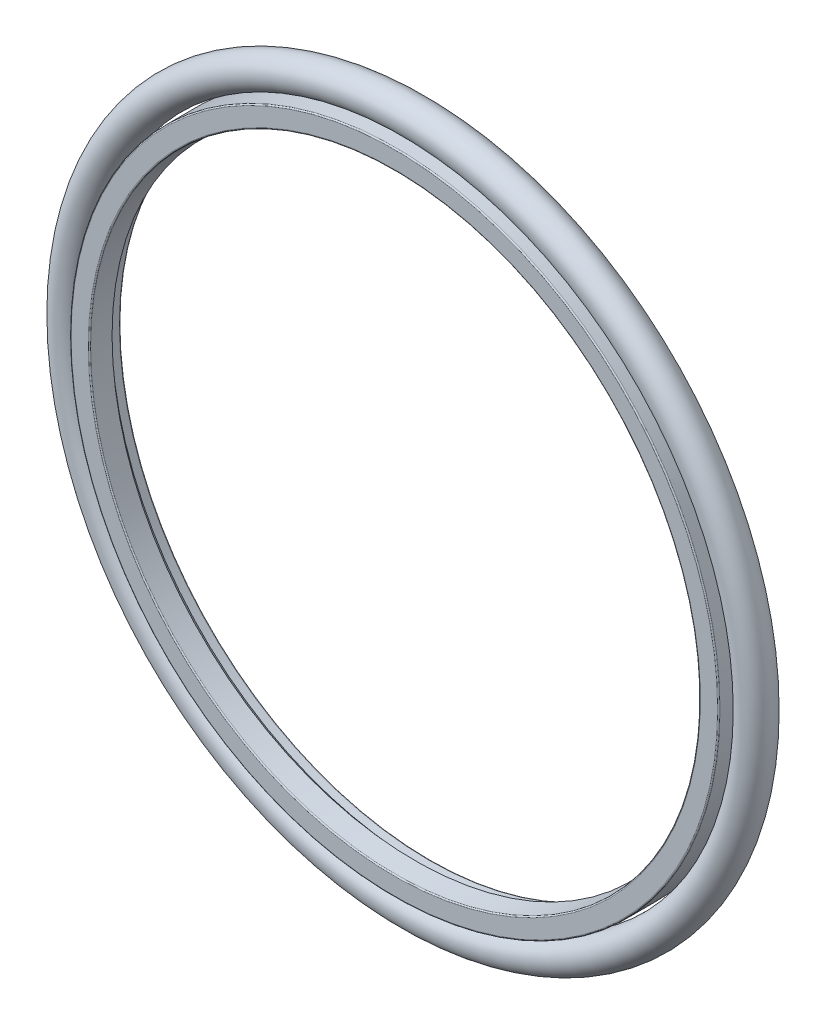
from build123d import *

# Parameters (mm, degrees)
SKETCH4_R = 2.665


with BuildPart() as part:
    # Sketch1 → Revolve1 (revolve)
    with BuildSketch(Plane(origin=(0, 0, 0), x_dir=(0, 0, -1), z_dir=(1, 0, 0)), mode=Mode.PRIVATE) as revolve1_sk:
        with BuildLine():
            Line((0, 51.05), (0, 53.05))
            ThreePointArc((0, 53.05), (-0.058578644, 53.191421356), (-0.2, 53.25))
            Line((-0.2, 53.25), (-5.72, 53.25))
            ThreePointArc((-5.72, 53.25), (-5.861421356, 53.191421356), (-5.92, 53.05))
            Line((-5.92, 53.05), (-5.92, 50.233224133))
            ThreePointArc((-5.92, 50.233224133), (-5.867470929, 50.098122967), (-5.73747675, 50.033989189))
            Line((-5.73747675, 50.033989189), (-2.5, 49.75))
            Line((-2.5, 49.75), (-1.5, 50.85))
            Line((-1.5, 50.85), (-0.2, 50.85))
            ThreePointArc((-0.2, 50.85), (-0.058578644, 50.908578644), (0, 51.05))
        make_face()
    revolve(revolve1_sk.sketch.rotate(Axis((0, 0, 0), (0, 0, 1)), 90), axis=Axis((0, 0, 0), (0, 0, 1)))


with BuildPart() as body_2:
    # Sketch4 → Revolve2 (revolve)
    with BuildSketch(Plane(origin=(0, 0, 0), x_dir=(0, 0, -1), z_dir=(1, 0, 0)), mode=Mode.PRIVATE) as revolve2_sk:
        with Locations((-2.86, 56.325)):
            Circle(SKETCH4_R)
    revolve(revolve2_sk.sketch.rotate(Axis((0, 0, 0), (0, 0, 1)), 90), axis=Axis((0, 0, 0), (0, 0, 1)))


solid = Compound([part.part, body_2.part])
